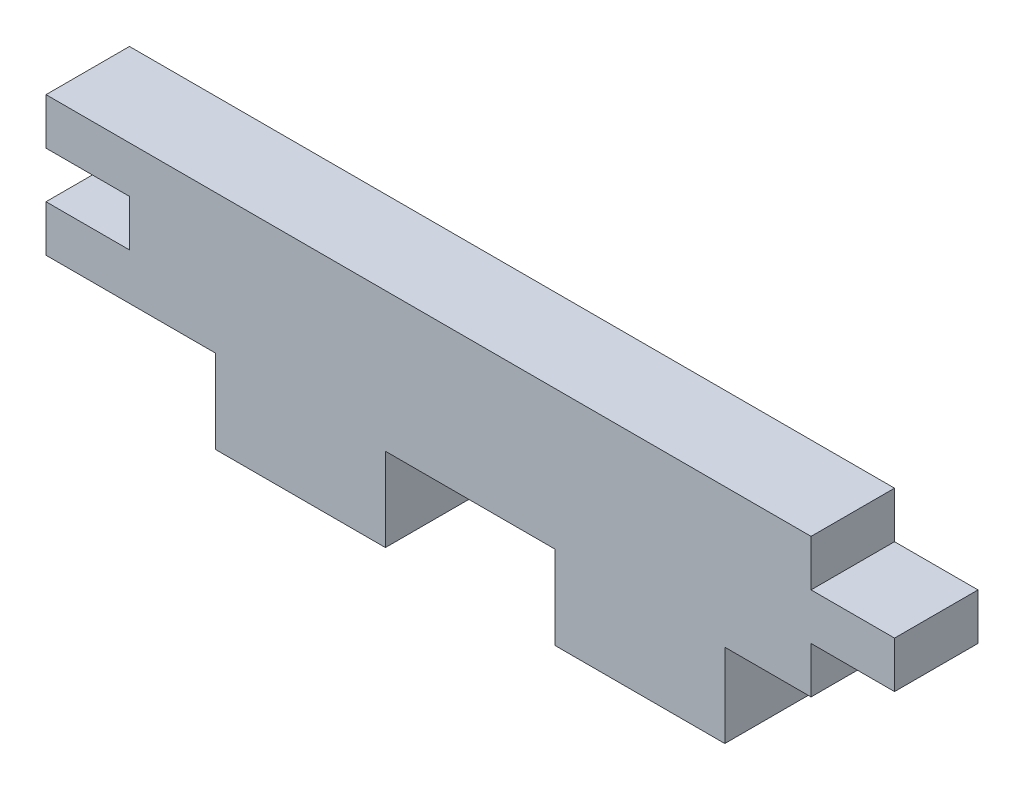
from build123d import *

# Parameters (mm, degrees)
SKETCH1_W           = 154.94
SKETCH1_H           = 40.64
BOSS_EXTRUDE1_DEPTH = 15.24
SKETCH2_W           = 30.988
SKETCH2_H           = 15.24
CUT_EXTRUDE1_DEPTH  = 161.904539401
SKETCH3_W           = 15.24
SKETCH3_H           = 8.466666666
SKETCH3_H_2         = 8.466666667
CUT_EXTRUDE2_DEPTH  = 161.904539401


with BuildPart() as part:
    # Sketch1 → Boss-Extrude1 (new body)
    with BuildSketch(Plane.XY):
        with Locations((77.47, 20.32)):
            Rectangle(SKETCH1_W, SKETCH1_H)
    extrude(amount=BOSS_EXTRUDE1_DEPTH)

    # Sketch2 → Cut-Extrude1 (cut, through all)
    with BuildSketch(Plane.XY.offset(15.24)):
        with Locations((15.494, 7.62)):
            Rectangle(SKETCH2_W, SKETCH2_H)
        with Locations((77.47, 7.62)):
            Rectangle(SKETCH2_W, SKETCH2_H)
        with Locations((139.446, 7.62)):
            Rectangle(SKETCH2_W, SKETCH2_H)
    extrude(amount=-CUT_EXTRUDE1_DEPTH, mode=Mode.SUBTRACT)

    # Sketch3 → Cut-Extrude2 (cut, through all)
    with BuildSketch(Plane.XY.offset(15.24)):
        with Locations((7.62, 27.94)):
            Rectangle(SKETCH3_W, SKETCH3_H)
        with Locations((147.32, 36.406666667)):
            Rectangle(SKETCH3_W, SKETCH3_H_2)
        with Locations((147.32, 19.473333334)):
            Rectangle(SKETCH3_W, SKETCH3_H_2)
    extrude(amount=-CUT_EXTRUDE2_DEPTH, mode=Mode.SUBTRACT)


solid = part.part
